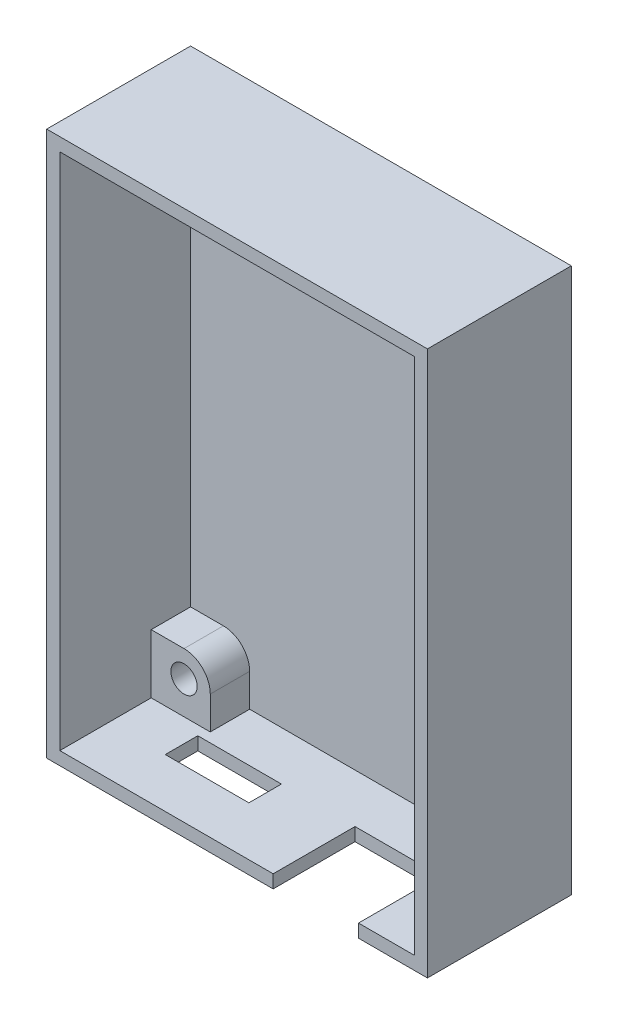
from build123d import *

# Parameters (mm, degrees)
SKETCH1_W           = 83
SKETCH1_H           = 58
BOSS_EXTRUDE1_DEPTH = 21.92
SHELL1_T            = -2
SKETCH2_R           = 2
BOSS_EXTRUDE2_DEPTH = 6
SKETCH3_W           = 12.74
SKETCH3_H           = 4.96
SKETCH3_W_2         = 13
SKETCH3_H_2         = 13
CUT_EXTRUDE1_DEPTH  = 2


with BuildPart() as part:
    # Sketch1 → Boss-Extrude1 (new body)
    with BuildSketch(Plane(origin=(0, 0, 0), x_dir=(0, 1, 0), z_dir=(0, 0, 1))):
        Rectangle(SKETCH1_W, SKETCH1_H)
    extrude(amount=BOSS_EXTRUDE1_DEPTH)

    # Shell1
    shell1_openings = [part.faces().sort_by_distance(p)[0] for p in [
        (0, 0, 21.92),
    ]]
    offset(amount=SHELL1_T, openings=shell1_openings, kind=Kind.INTERSECTION)

    # Sketch2 → Boss-Extrude2 (add)
    # profile 1 of 4: a face of its own
    with BuildSketch(Plane.XY.offset(2)):
        with BuildLine():
            Line((-27, 39.5), (-18, 39.5))
            Line((-18, 39.5), (-18, 34.5))
            ThreePointArc((-18, 34.5), (-19.171572875, 31.671572875), (-22, 30.5))
            Line((-22, 30.5), (-27, 30.5))
            Line((-27, 30.5), (-27, 39.5))
        make_face()
        with Locations((-22, 34.5)):
            Circle(SKETCH2_R, mode=Mode.SUBTRACT)
    # profile 2 of 4: a face of its own
    with BuildSketch(Plane.XY.offset(2)):
        with BuildLine():
            Line((18, 39.5), (18, 34.5))
            ThreePointArc((18, 34.5), (19.171572875, 31.671572875), (22, 30.5))
            Line((22, 30.5), (27, 30.5))
            Line((27, 30.5), (27, 39.5))
            Line((27, 39.5), (18, 39.5))
        make_face()
        with Locations(Location((22, 34.5, 0), (0, 0, 180))):
            Circle(SKETCH2_R, mode=Mode.SUBTRACT)
    # profile 3 of 4: a face of its own
    with BuildSketch(Plane.XY.offset(2)):
        with BuildLine():
            Line((27, -39.5), (18, -39.5))
            Line((18, -39.5), (18, -34.5))
            ThreePointArc((18, -34.5), (19.171572875, -31.671572875), (22, -30.5))
            Line((22, -30.5), (27, -30.5))
            Line((27, -30.5), (27, -39.5))
        make_face()
        with Locations((22, -34.5)):
            Circle(SKETCH2_R, mode=Mode.SUBTRACT)
    # profile 4 of 4: a face of its own
    with BuildSketch(Plane.XY.offset(2)):
        with BuildLine():
            Line((-18, -39.5), (-18, -34.5))
            ThreePointArc((-18, -34.5), (-19.171572875, -31.671572875), (-22, -30.5))
            Line((-22, -30.5), (-27, -30.5))
            Line((-27, -30.5), (-27, -39.5))
            Line((-27, -39.5), (-18, -39.5))
        make_face()
        with Locations(Location((-22, -34.5, 0), (0, 0, 180))):
            Circle(SKETCH2_R, mode=Mode.SUBTRACT)
    extrude(amount=BOSS_EXTRUDE2_DEPTH)

    # Sketch3 → Cut-Extrude1 (cut)
    with BuildSketch(Plane.XZ.offset(41.5)):
        with Locations((-12.08, 11.93)):
            Rectangle(SKETCH3_W, SKETCH3_H)
        with Locations((12, 15.95)):
            Rectangle(SKETCH3_W_2, SKETCH3_H_2)
    extrude(amount=-CUT_EXTRUDE1_DEPTH, mode=Mode.SUBTRACT)


solid = part.part
